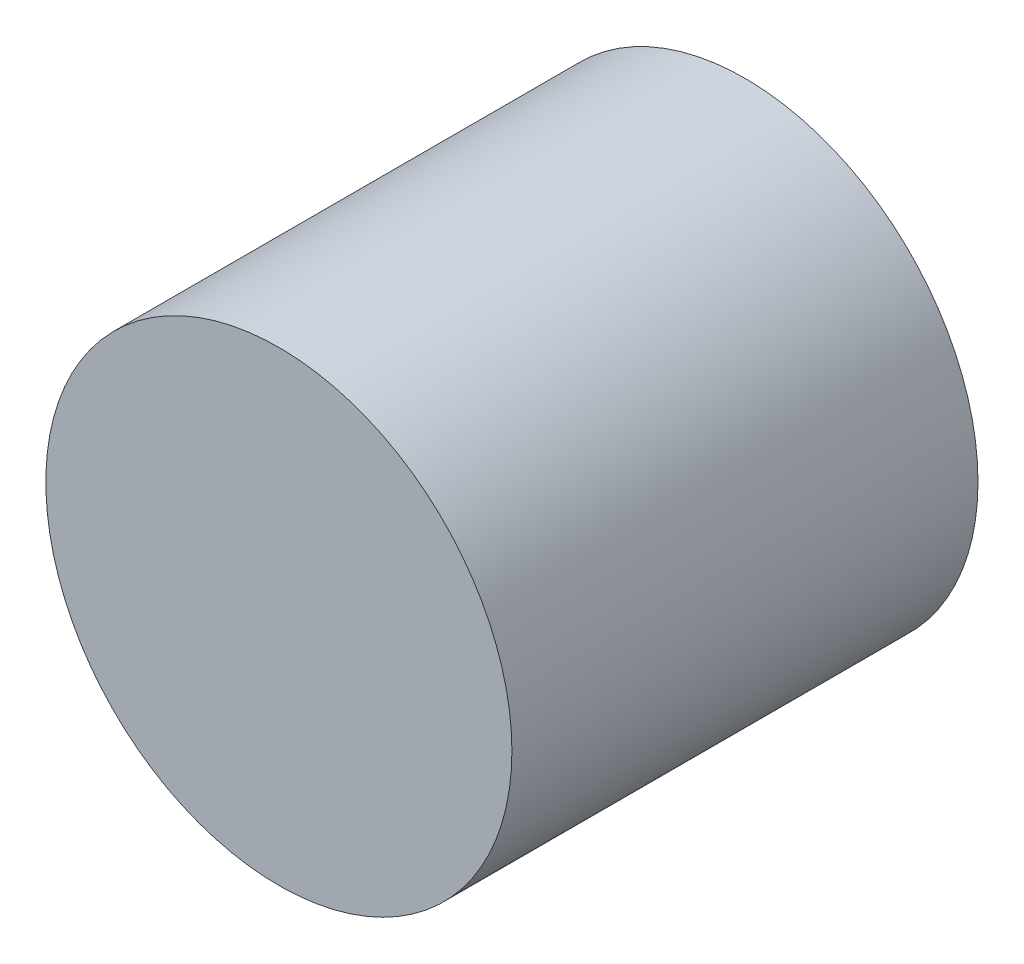
from build123d import *

# Parameters (mm, degrees)
SKETCH2_R                 = 3
M2P5_CLEARANCE_POST_DEPTH = 6


with BuildPart() as part:
    # Sketch2 → M2p5_clearance_post (new body)
    with BuildSketch(Plane.XY):
        Circle(SKETCH2_R)
    extrude(amount=M2P5_CLEARANCE_POST_DEPTH)


solid = part.part
